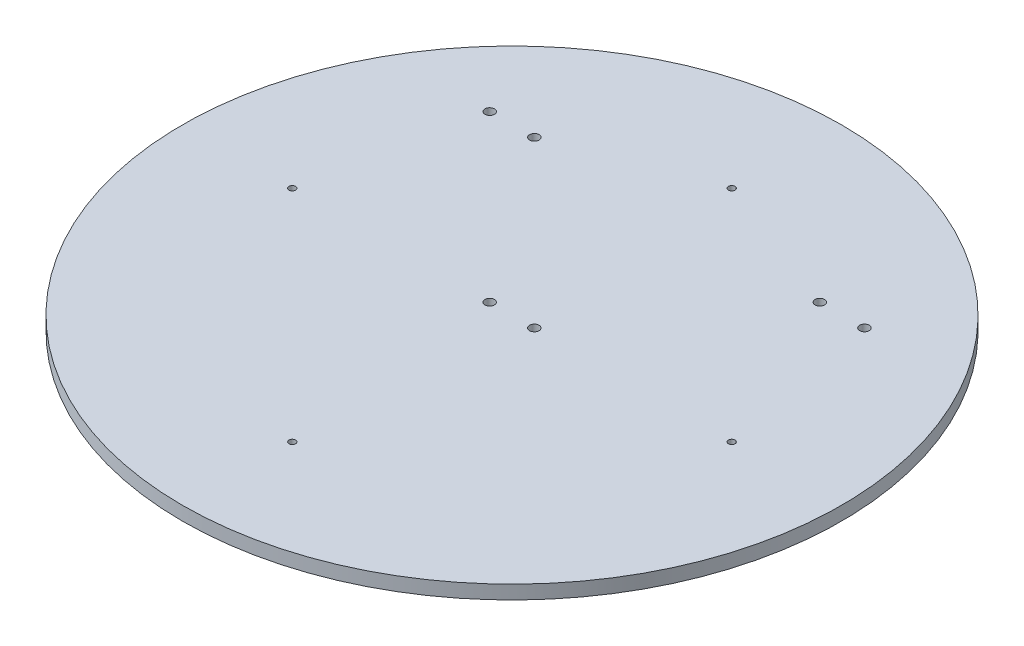
from build123d import *

# Parameters (mm, degrees)
SKETCH1_R           = 152.4
BOSS_EXTRUDE1_DEPTH = 3.175
SKETCH3_R           = 2.20345
CUT_EXTRUDE1_DEPTH  = 216.619670949
SKETCH5_R           = 1.524
CUT_EXTRUDE3_DEPTH  = 216.619670949


with BuildPart() as part:
    # Sketch1 → Boss-Extrude1 (new, symmetric)
    with BuildSketch(Plane(origin=(0, 0, 0), x_dir=(1, 0, 0), z_dir=(0, 1, 0))):
        with Locations(Location((0, 0, 0), (0, 0, 270))):
            Circle(SKETCH1_R)
    extrude(amount=BOSS_EXTRUDE1_DEPTH, both=True)

    # Sketch3 → Cut-Extrude1 (cut, through all)
    with BuildSketch(Plane(origin=(0, 3.175, 0), x_dir=(1, 0, 0), z_dir=(0, 1, 0))):
        with Locations(Location((-10.31875, 0, 0), (0, 0, 270))):
            Circle(SKETCH3_R)
        with Locations(Location((10.31875, 0, 0), (0, 0, 270))):
            Circle(SKETCH3_R)
        with Locations(Location((66.013427029, 76.332177029, 0), (0, 0, 270))):
            Circle(SKETCH3_R)
        with Locations(Location((86.650927029, 76.332177029, 0), (0, 0, 270))):
            Circle(SKETCH3_R)
        with Locations(Location((-86.650927029, 76.332177029, 0), (0, 0, 270))):
            Circle(SKETCH3_R)
        with Locations(Location((-66.013427029, 76.332177029, 0), (0, 0, 270))):
            Circle(SKETCH3_R)
    extrude(amount=-CUT_EXTRUDE1_DEPTH, mode=Mode.SUBTRACT)

    # Sketch5 → Cut-Extrude3 (cut, through all)
    with BuildSketch(Plane(origin=(0, 3.175, 0), x_dir=(1, 0, 0), z_dir=(0, 1, 0))):
        with Locations(Location((-101.6, 0, 0), (0, 0, 270))):
            Circle(SKETCH5_R)
        with Locations(Location((0, 101.6, 0), (0, 0, 270))):
            Circle(SKETCH5_R)
        with Locations(Location((101.6, 0, 0), (0, 0, 270))):
            Circle(SKETCH5_R)
        with Locations(Location((0, -101.6, 0), (0, 0, 270))):
            Circle(SKETCH5_R)
    extrude(amount=-CUT_EXTRUDE3_DEPTH, mode=Mode.SUBTRACT)


solid = part.part
